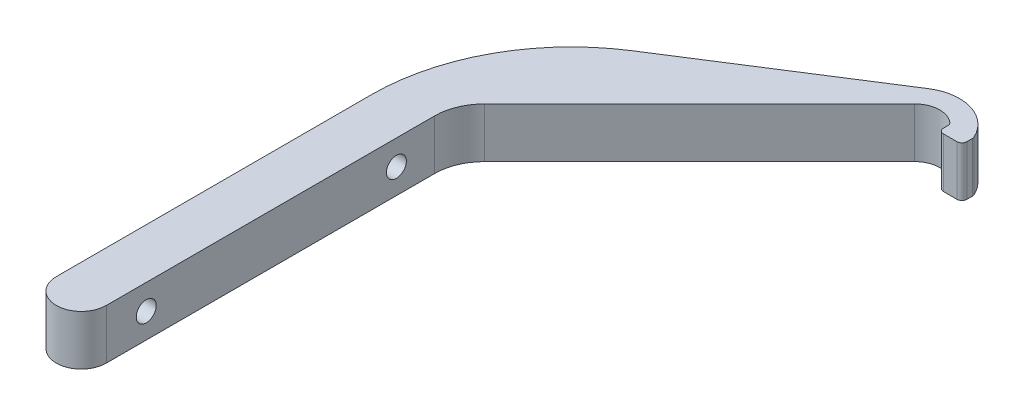
from build123d import *

# Parameters (mm, degrees)
BOSS_EXTRUDE1_DEPTH = 10
SKETCH4_R           = 2
CUT_EXTRUDE3_DEPTH  = 10


with BuildPart() as part:
    # Sketch1 → Boss-Extrude1 (new body)
    with BuildSketch(Plane(origin=(0, 0, 0), x_dir=(1, 0, 0), z_dir=(0, 1, 0))):
        with BuildLine():
            Line((0, 0), (0, 53.055248535))
            ThreePointArc((0, 53.055248535), (4.930929772, 72.294799292), (18.508015666, 86.790906367))
            Line((18.508015666, 86.790906367), (54.686952948, 109.839431377))
            ThreePointArc((54.686952948, 109.839431377), (62.025319105, 110.877302623), (67.631481029, 106.029649267))
            ThreePointArc((67.631481029, 106.029649267), (67.699832136, 105.82566515), (67.722972833, 105.611782234))
            Line((67.722972833, 105.611782234), (67.722972833, 104.504374958))
            ThreePointArc((67.722972833, 104.504374958), (67.430079614, 103.797268177), (66.722972833, 103.504374958))
            Line((66.722972833, 103.504374958), (64.033008589, 103.504374958))
            ThreePointArc((64.033008589, 103.504374958), (63.325901808, 103.797268177), (63.033008589, 104.504374958))
            Line((63.033008589, 104.504374958), (63.033008589, 105.382139034))
            ThreePointArc((63.033008589, 105.382139034), (62.936856883, 105.809992118), (62.666892065, 106.155567594))
            ThreePointArc((62.666892065, 106.155567594), (59.250489983, 107.282320922), (55.961940777, 105.823958698))
            Line((55.961940777, 105.823958698), (12.928932188, 62.790950109))
            ThreePointArc((12.928932188, 62.790950109), (10.761204675, 59.546716621), (10, 55.719882297))
            Line((10, 55.719882297), (10, -0.137982079))
            Line((10, -0.137982079), (10, -10))
            ThreePointArc((10, -10), (5, -15), (0, -10))
            Line((0, -10), (0, 0))
        make_face()
    extrude(amount=BOSS_EXTRUDE1_DEPTH)

    # Sketch4 → Cut-Extrude3 (cut)
    with BuildSketch(Plane.ZY):
        with Locations((-48.055248535, 5)):
            Circle(SKETCH4_R)
        with Locations((2, 5)):
            Circle(SKETCH4_R)
    extrude(amount=-CUT_EXTRUDE3_DEPTH, mode=Mode.SUBTRACT)


solid = part.part
